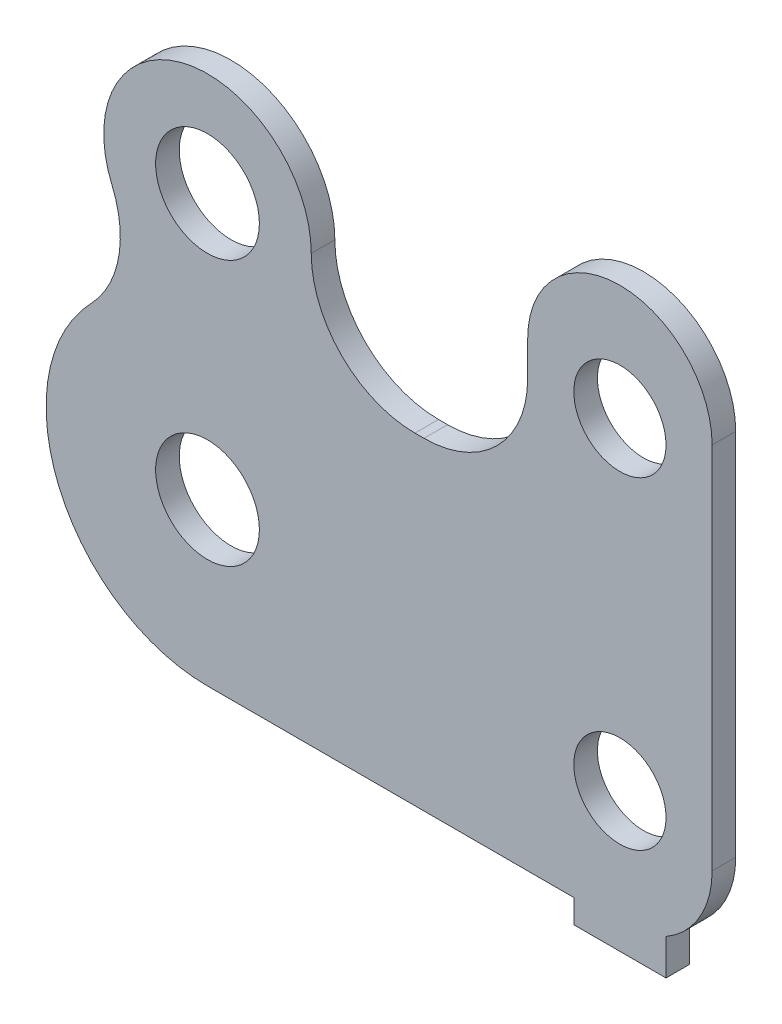
from build123d import *

# Parameters (mm, degrees)
SKETCH1_R           = 1.7859375
SKETCH1_R_2         = 1.5875
BOSS_EXTRUDE1_DEPTH = 0.8128


with BuildPart() as part:
    # Sketch1 → Boss-Extrude1 (new body)
    with BuildSketch(Plane.XY):
        with BuildLine():
            Line((17.374031657, -2.38125), (17.374031657, 10.31875))
            ThreePointArc((17.374031657, 10.31875), (14.199031657, 13.49375), (11.024031657, 10.31875))
            Line((11.024031657, 10.31875), (11.024031657, 9.128125))
            ThreePointArc((11.024031657, 9.128125), (9.977853691, 6.602427966), (7.452156657, 5.55625))
            Line((7.452156657, 5.55625), (7.14374999, 5.55625))
            ThreePointArc((7.14374999, 5.55625), (4.618052962, 6.602427969), (3.571875, 9.128125))
            ThreePointArc((3.571875, 9.128125), (-0.713207259, 12.628071631), (-3.287058429, 7.730434799))
            ThreePointArc((-3.287058429, 7.730434799), (-3.061446655, 5.68510334), (-4.001636336, 3.854714088))
            ThreePointArc((-4.001636336, 3.854714088), (-5.113201992, -2.17418478), (0, -5.55625))
            Line((0, -5.55625), (12.611531657, -5.55625))
            Line((12.611531657, -5.55625), (12.611531657, -6.36905))
            Line((12.611531657, -6.36905), (15.786531657, -6.36905))
            Line((15.786531657, -6.36905), (15.786531657, -5.130880657))
            ThreePointArc((15.786531657, -5.130880657), (16.948662314, -3.96875), (17.374031657, -2.38125))
        make_face()
        Circle(SKETCH1_R, mode=Mode.SUBTRACT)
        with Locations((14.199031657, -1.5875)):
            Circle(SKETCH1_R_2, mode=Mode.SUBTRACT)
        with Locations((0, 9.128125)):
            Circle(SKETCH1_R, mode=Mode.SUBTRACT)
        with Locations((14.199031657, 9.525)):
            Circle(SKETCH1_R_2, mode=Mode.SUBTRACT)
    extrude(amount=BOSS_EXTRUDE1_DEPTH)


solid = part.part
